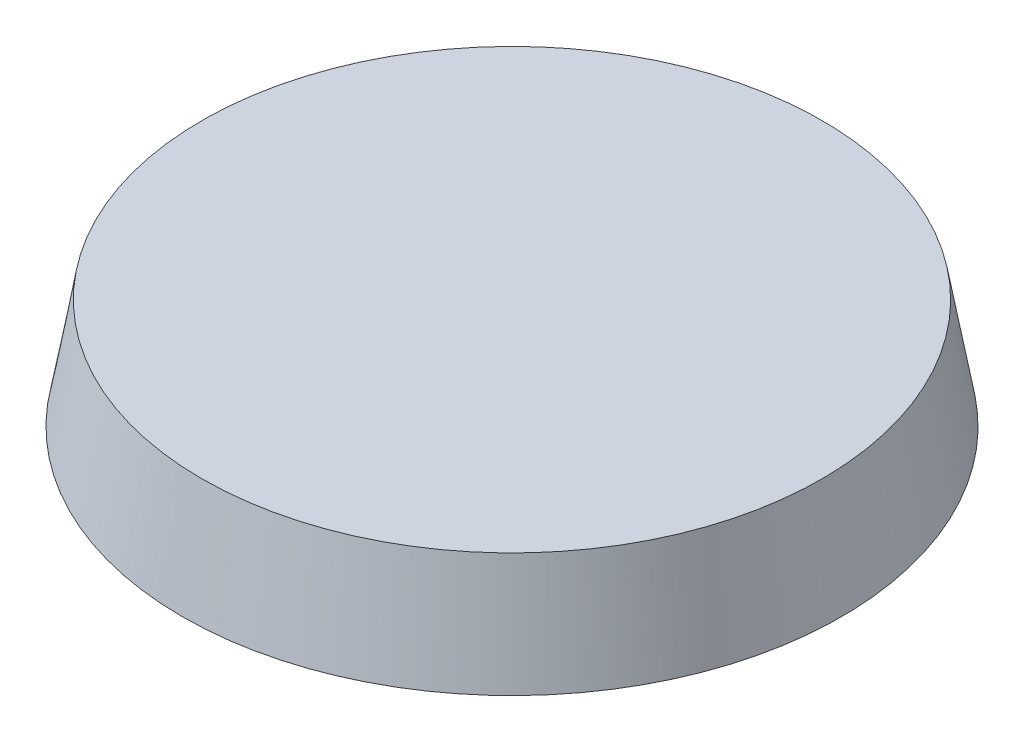
from build123d import *

# Parameters (mm, degrees)
SKETCH2_R           = 150
BOSS_EXTRUDE1_DEPTH = 50
BOSS_EXTRUDE1_TAPER = 10


with BuildPart() as part:
    # Sketch2 → Boss-Extrude1 (new body)
    with BuildSketch(Plane(origin=(0, 0, 0), x_dir=(1, 0, 0), z_dir=(0, 1, 0))):
        Circle(SKETCH2_R)
    extrude(amount=BOSS_EXTRUDE1_DEPTH, taper=BOSS_EXTRUDE1_TAPER)


solid = part.part
